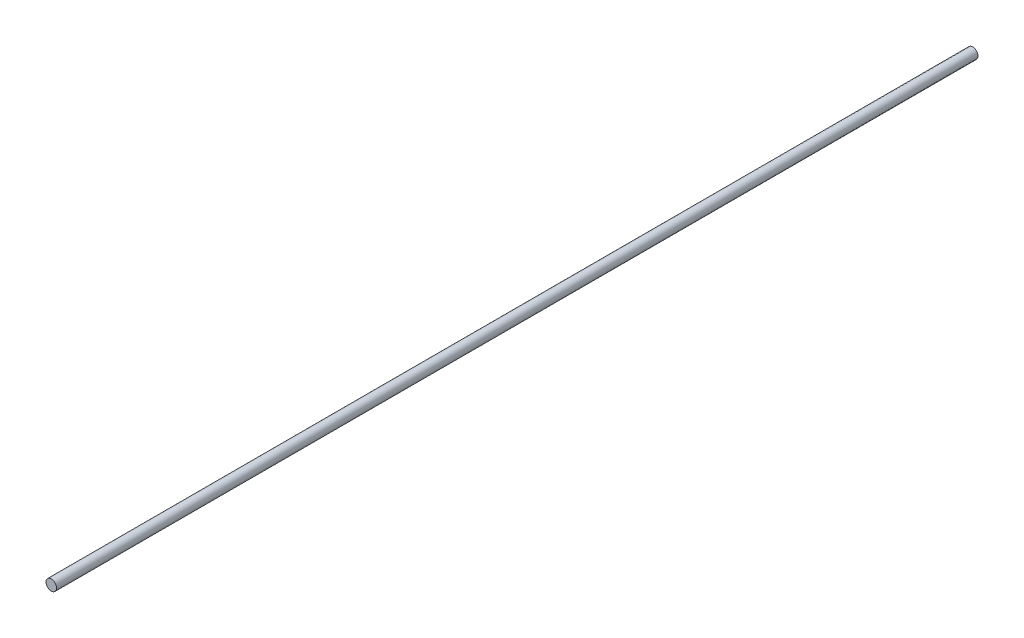
from build123d import *

# Parameters (mm, degrees)
SKETCH_1_R      = 4
EXTRUDE_1_DEPTH = 700


with BuildPart() as part:
    # Эскиз1 → Бобышка-Вытянуть1 (new body)
    with BuildSketch(Plane.XY):
        Circle(SKETCH_1_R)
    extrude(amount=EXTRUDE_1_DEPTH)


solid = part.part
